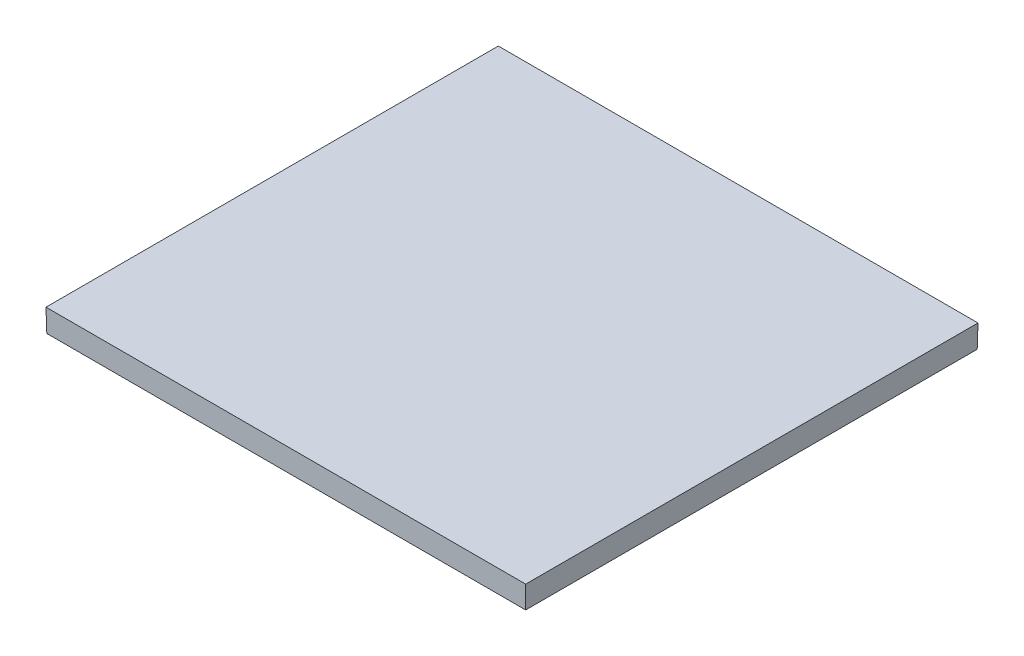
from build123d import *

# Parameters (mm, degrees)
SKETCH1_W           = 210
SKETCH1_H           = 198
BOSS_EXTRUDE1_DEPTH = 10
BOSS_EXTRUDE1_DRAFT = -1


with BuildPart() as part:
    # Sketch1 → Boss-Extrude1 (with draft: the straight prism first)
    with BuildSketch(Plane(origin=(0, 0, 0), x_dir=(1, 0, 0), z_dir=(0, 1, 0))):
        Rectangle(SKETCH1_W, SKETCH1_H)
    extrude(amount=BOSS_EXTRUDE1_DEPTH)
    # Boss-Extrude1: the draft: its side faces are tilted about the plane it starts from
    boss_extrude1_sides = [part.faces().sort_by_distance(p)[0] for p in [
        (0, 5, 99),
        (105, 5, 0),
        (0, 5, -99),
        (-105, 5, 0),
    ]]
    draft(boss_extrude1_sides, Plane(origin=(0, 0, 0), x_dir=(1, 0, 0), z_dir=(0, 1, 0)), BOSS_EXTRUDE1_DRAFT)


solid = part.part
